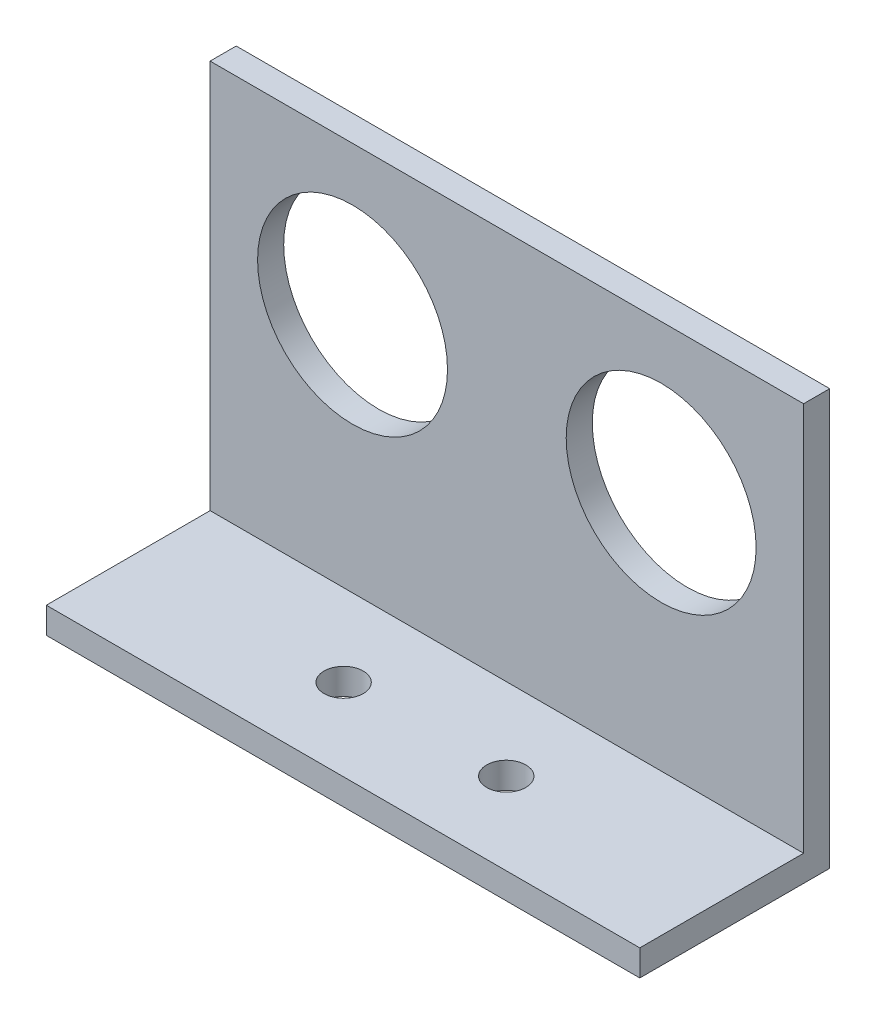
from build123d import *

# Parameters (mm, degrees)
SKETCH_1_W          = 50
SKETCH_1_H          = 35
EXTRUDE_1_DEPTH     = 2.2
SKETCH_2_R          = 8
CUT_EXTRUDE_1_DEPTH = 2.2
SKETCH_3_W          = 50
SKETCH_3_H          = 2.2
EXTRUDE_2_DEPTH     = 13.8
SKETCH_4_R          = 1.65
CUT_EXTRUDE_2_DEPTH = 13.8


with BuildPart() as part:
    # 草图1 → 凸台-拉伸1 (new body)
    with BuildSketch(Plane.XY):
        with Locations((25, 17.5)):
            Rectangle(SKETCH_1_W, SKETCH_1_H)
    extrude(amount=EXTRUDE_1_DEPTH)

    # 草图2 → 切除-拉伸1 (cut)
    with BuildSketch(Plane.XY.offset(2.2)):
        with Locations((12, 22.5)):
            Circle(SKETCH_2_R)
        with Locations((38, 22.5)):
            Circle(SKETCH_2_R)
    extrude(amount=-CUT_EXTRUDE_1_DEPTH, mode=Mode.SUBTRACT)

    # 草图3 → 凸台-拉伸2 (add)
    with BuildSketch(Plane.XY.offset(2.2)):
        with Locations((25, 1.1)):
            Rectangle(SKETCH_3_W, SKETCH_3_H)
    extrude(amount=EXTRUDE_2_DEPTH)

    # 草图4 → 切除-拉伸2 (cut)
    with BuildSketch(Plane(origin=(0, 2.2, 0), x_dir=(1, 0, 0), z_dir=(0, 1, 0))):
        with Locations(Location((18.15, -9.1, 0), (0, 0, 270))):
            Circle(SKETCH_4_R)
        with Locations(Location((31.85, -9.1, 0), (0, 0, 270))):
            Circle(SKETCH_4_R)
    extrude(amount=-CUT_EXTRUDE_2_DEPTH, mode=Mode.SUBTRACT)


solid = part.part
